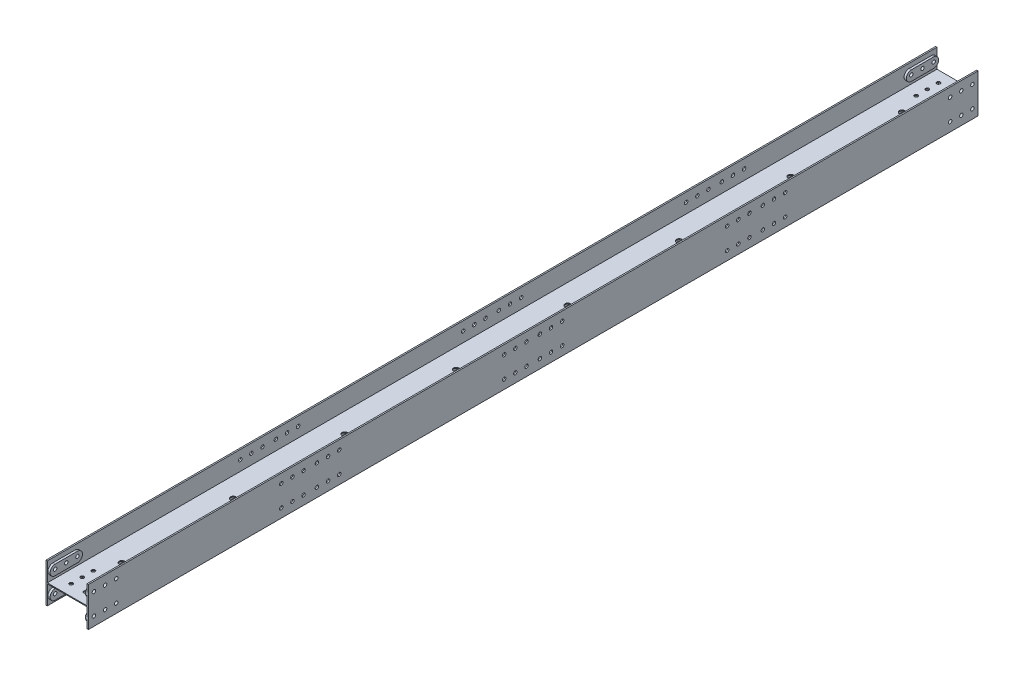
from build123d import *

# Parameters (mm, degrees)
EXTRUDE_1_DEPTH             = 3990
EXTRUDE_2_DEPTH             = 20
PATTERN_LINEAR_1_COUNT      = 2
PATTERN_LINEAR_1_PITCH      = 190
PATTERN_LINEAR_1_COUNT_DIR2 = 2
PATTERN_LINEAR_1_PITCH_DIR2 = 336
SKETCH_2_R                  = 15.5
CUT_EXTRUDE_3_DEPTH         = 4012.873003972
SKETCH_4_R                  = 15.5
SKETCH_4_R_2                = 25
CUT_EXTRUDE_4_DEPTH         = 3999.529854834


with BuildPart() as part:
    # 草图1 → 拉伸1 (new body)
    with BuildSketch(Plane.XY):
        Polygon((-178, 175), (-190, 175), (-190, -175), (-178, -175), (-178, -4), (178, -4), (178, -175), (190, -175), (190, 175), (178, 175), (178, 4), (-178, 4), align=None)
    extrude(amount=EXTRUDE_1_DEPTH)

    # 草图3 → 拉伸2 (add)
    with BuildSketch(Plane(origin=(-178, 0, 0), x_dir=(0, 0, -1), z_dir=(1, 0, 0))):
        with BuildLine():
            Line((-3940, 134.5), (-3740, 134.5))
            ThreePointArc((-3740, 134.5), (-3695, 89.5), (-3740, 44.5))
            Line((-3740, 44.5), (-3940, 44.5))
            ThreePointArc((-3940, 44.5), (-3985, 89.5), (-3940, 134.5))
        make_face()
    extrude_2 = extrude(amount=EXTRUDE_2_DEPTH)

    # 阵列(线性)1: Extrude 2 2 × 2
    with Locations(*[(j * PATTERN_LINEAR_1_PITCH_DIR2, -i * PATTERN_LINEAR_1_PITCH, 0) for i in range(PATTERN_LINEAR_1_COUNT) for j in range(PATTERN_LINEAR_1_COUNT_DIR2) if (i, j) != (0, 0)]):
        add(extrude_2)

    # 草图2 → 拉伸3 (cut, through all)
    with BuildSketch(Plane(origin=(190, 0, 0), x_dir=(0, 0, -1), z_dir=(1, 0, 0))):
        with Locations(Location((-3940, 95, 0), (0, 0, 90))):
            Circle(SKETCH_2_R)
        with Locations(Location((-3840, 95, 0), (0, 0, 90))):
            Circle(SKETCH_2_R)
        with Locations(Location((-3740, 95, 0), (0, 0, 90))):
            Circle(SKETCH_2_R)
        with Locations(Location((-3940, -95, 0), (0, 0, 90))):
            Circle(SKETCH_2_R)
        with Locations(Location((-3840, -95, 0), (0, 0, 90))):
            Circle(SKETCH_2_R)
        with Locations(Location((-3740, -95, 0), (0, 0, 90))):
            Circle(SKETCH_2_R)
        with Locations(Location((-2260, 95, 0), (0, 0, 90))):
            Circle(SKETCH_2_R)
        with Locations(Location((-2160, 95, 0), (0, 0, 90))):
            Circle(SKETCH_2_R)
        with Locations(Location((-2060, 95, 0), (0, 0, 90))):
            Circle(SKETCH_2_R)
        with Locations(Location((-2260, -95, 0), (0, 0, 90))):
            Circle(SKETCH_2_R)
        with Locations(Location((-2160, -95, 0), (0, 0, 90))):
            Circle(SKETCH_2_R)
        with Locations(Location((-2060, -95, 0), (0, 0, 90))):
            Circle(SKETCH_2_R)
        with Locations(Location((-1740, 95, 0), (0, 0, 90))):
            Circle(SKETCH_2_R)
        with Locations(Location((-1940, 95, 0), (0, 0, 90))):
            Circle(SKETCH_2_R)
        with Locations(Location((-1840, 95, 0), (0, 0, 90))):
            Circle(SKETCH_2_R)
        with Locations(Location((-1940, -95, 0), (0, 0, 90))):
            Circle(SKETCH_2_R)
        with Locations(Location((-1840, -95, 0), (0, 0, 90))):
            Circle(SKETCH_2_R)
        with Locations(Location((-1740, -95, 0), (0, 0, 90))):
            Circle(SKETCH_2_R)
        with Locations(Location((-260, 95, 0), (0, 0, 90))):
            Circle(SKETCH_2_R)
        with Locations(Location((-60, 95, 0), (0, 0, 90))):
            Circle(SKETCH_2_R)
        with Locations(Location((-60, -95, 0), (0, 0, 90))):
            Circle(SKETCH_2_R)
        with Locations(Location((-160, 95, 0), (0, 0, 90))):
            Circle(SKETCH_2_R)
        with Locations(Location((-160, -95, 0), (0, 0, 90))):
            Circle(SKETCH_2_R)
        with Locations(Location((-260, -95, 0), (0, 0, 90))):
            Circle(SKETCH_2_R)
    extrude(amount=-CUT_EXTRUDE_3_DEPTH, mode=Mode.SUBTRACT)

    # 镜向1: part across plane


with BuildPart() as part_1:
    add(part.part)
    add(part.part.mirror(Plane.XY))

    # 草图4 → 拉伸4 (cut, through all)
    with BuildSketch(Plane(origin=(0, 4, 0), x_dir=(1, 0, 0), z_dir=(0, 1, 0))):
        with Locations(Location((65, 3890, 0), (0, 0, 270))):
            Circle(SKETCH_4_R)
        with Locations(Location((-65, 3890, 0), (0, 0, 270))):
            Circle(SKETCH_4_R)
        with Locations(Location((65, 3790, 0), (0, 0, 270))):
            Circle(SKETCH_4_R)
        with Locations(Location((-65, 3790, 0), (0, 0, 270))):
            Circle(SKETCH_4_R)
        with Locations(Location((65, 3690, 0), (0, 0, 270))):
            Circle(SKETCH_4_R)
        with Locations(Location((-65, 3690, 0), (0, 0, 270))):
            Circle(SKETCH_4_R)
        with Locations(Location((0, 3500, 0), (0, 0, 270))):
            Circle(SKETCH_4_R_2)
        with Locations(Location((0, 2500, 0), (0, 0, 270))):
            Circle(SKETCH_4_R_2)
        with Locations(Location((0, 1500, 0), (0, 0, 270))):
            Circle(SKETCH_4_R_2)
        with Locations(Location((0, 500, 0), (0, 0, 270))):
            Circle(SKETCH_4_R_2)
        with Locations(Location((65, -3790, 0), (0, 0, 270))):
            Circle(SKETCH_4_R)
        with Locations(Location((65, -3890, 0), (0, 0, 270))):
            Circle(SKETCH_4_R)
        with Locations(Location((-65, -3890, 0), (0, 0, 270))):
            Circle(SKETCH_4_R)
        with Locations(Location((-65, -3790, 0), (0, 0, 270))):
            Circle(SKETCH_4_R)
        with Locations(Location((65, -3690, 0), (0, 0, 270))):
            Circle(SKETCH_4_R)
        with Locations(Location((-65, -3690, 0), (0, 0, 270))):
            Circle(SKETCH_4_R)
        with Locations(Location((0, -3500, 0), (0, 0, 270))):
            Circle(SKETCH_4_R_2)
        with Locations(Location((0, -2500, 0), (0, 0, 270))):
            Circle(SKETCH_4_R_2)
        with Locations(Location((0, -1500, 0), (0, 0, 270))):
            Circle(SKETCH_4_R_2)
        with Locations(Location((0, -500, 0), (0, 0, 270))):
            Circle(SKETCH_4_R_2)
    extrude(amount=-CUT_EXTRUDE_4_DEPTH, mode=Mode.SUBTRACT)


solid = part_1.part
